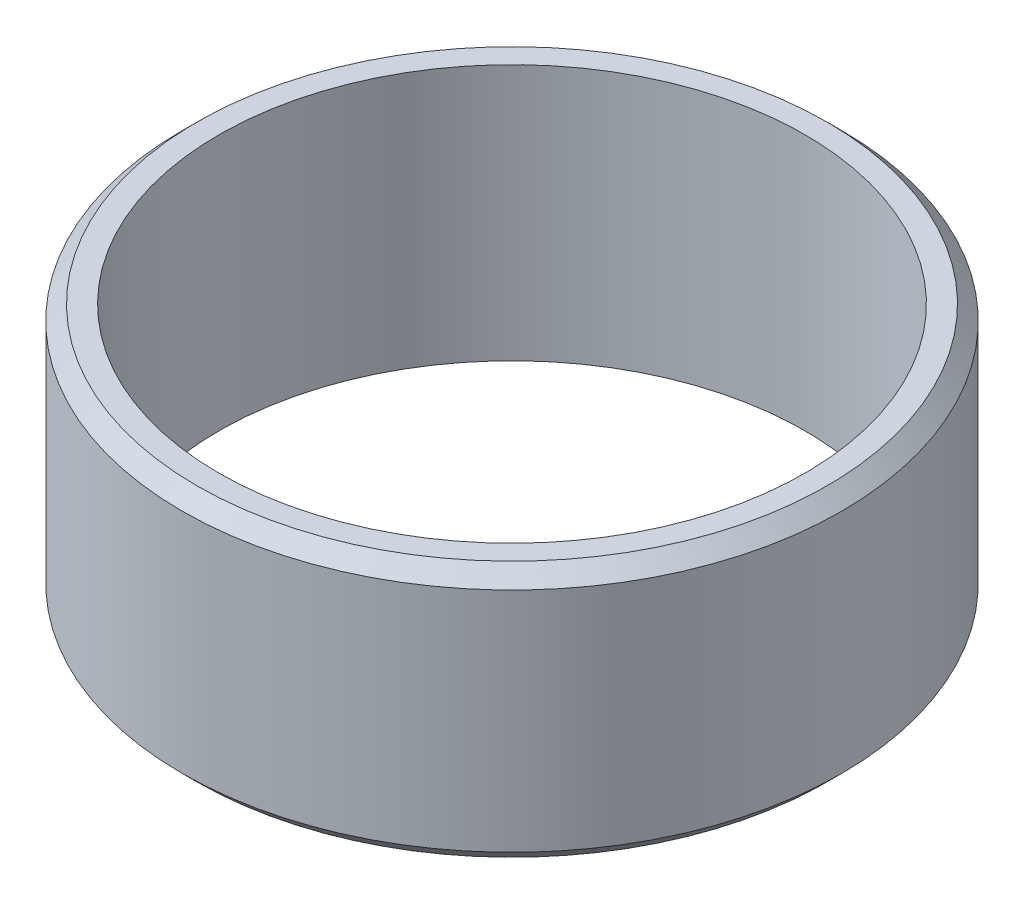
from build123d import *

# Parameters (mm, degrees)
SKETCH_1_R      = 4.5
SKETCH_1_R_2    = 4
EXTRUDE_1_DEPTH = 3.5
CHAMFER_1_SIZE  = 0.2


with BuildPart() as part:
    # 스케치1 → 보스-돌출1 (new body)
    with BuildSketch(Plane(origin=(0, 0, 0), x_dir=(1, 0, 0), z_dir=(0, 1, 0))):
        with Locations(Location((0, 0, 0), (0, 0, 270))):
            Circle(SKETCH_1_R)
        with Locations(Location((0, 0, 0), (0, 0, 270))):
            Circle(SKETCH_1_R_2, mode=Mode.SUBTRACT)
    extrude(amount=EXTRUDE_1_DEPTH)

    # 모따기1
    chamfer_1_edges = [part.edges().sort_by_distance(p)[0] for p in [
        (0, 0, -4.5),
        (0, 3.5, -4.5),
    ]]
    chamfer(chamfer_1_edges, length=CHAMFER_1_SIZE)


solid = part.part
